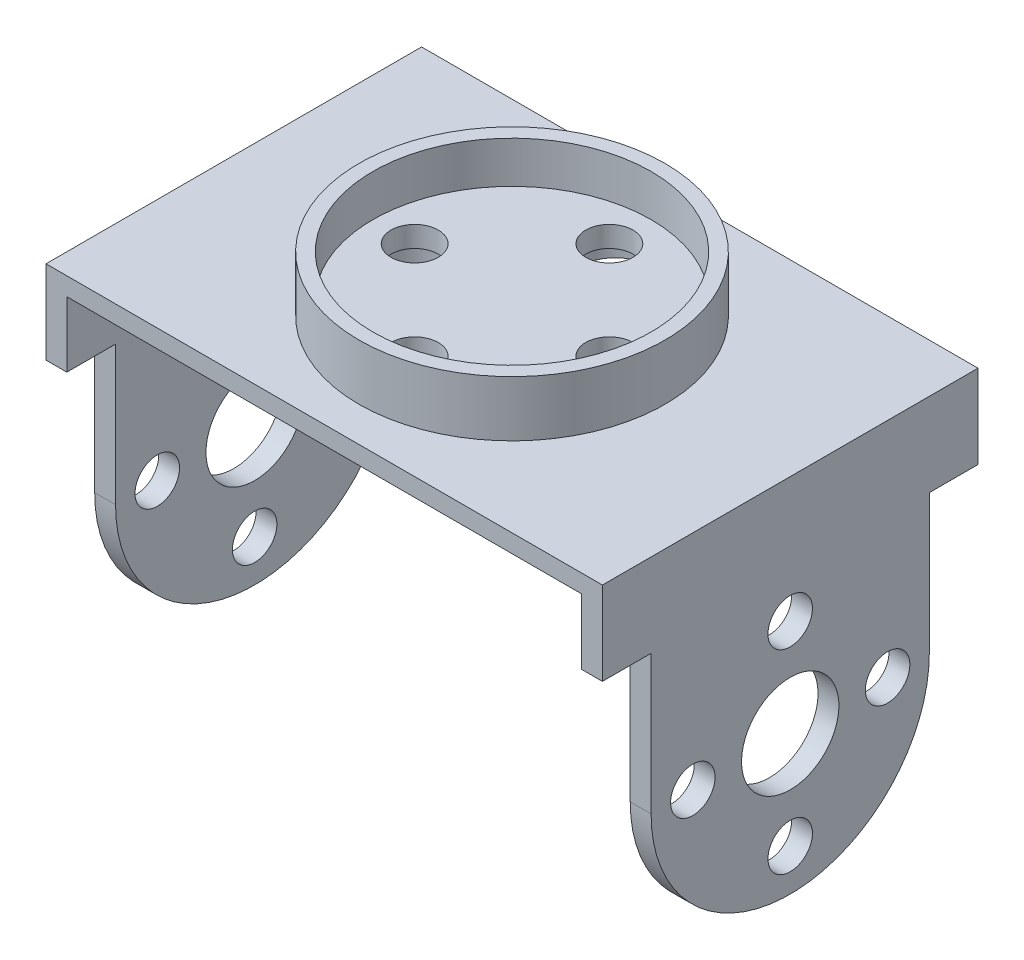
from build123d import *

# Parameters (mm, degrees)
SKETCH_1_W               = 40
SKETCH_1_H               = 28
EXTRUDE_1_DEPTH          = 27
SKETCH_2_W               = 37
SKETCH_2_H               = 27
CUT_EXTRUDE_1_DEPTH      = 25
SKETCH_3_R               = 1.6
SKETCH_3_R_2             = 3.5
CUT_EXTRUDE_2_DEPTH      = 56.794264938
SKETCH_4_R               = 11
SKETCH_4_R_2             = 10
EXTRUDE_2_DEPTH          = 4
SKETCH_11_R              = 10
EXTRUDE_3_DEPTH          = 1
CUT_EXTRUDE_3_DEPTH      = 56.794264938
CUT_EXTRUDE_3_DEPTH_BACK = 56.794264938
SKETCH_6_R               = 1.7
SKETCH_7_R               = 2.8
CUT_EXTRUDE_4_DEPTH      = 2.5
CUT_EXTRUDE_6_REACH      = 58.879
CUT_EXTRUDE_5_DEPTH      = 58.905094767


with BuildPart() as part:
    # 草图1 → 凸台-拉伸1 (new body)
    with BuildSketch(Plane.XY):
        with Locations((20, 14)):
            Rectangle(SKETCH_1_W, SKETCH_1_H)
    extrude(amount=EXTRUDE_1_DEPTH)

    # 草图2 → 切除-拉伸1 (cut)
    with BuildSketch(Plane.XZ):
        with Locations((20, 13.5)):
            Rectangle(SKETCH_2_W, SKETCH_2_H)
    extrude(amount=-CUT_EXTRUDE_1_DEPTH, mode=Mode.SUBTRACT)

    # 草图3 → 切除-拉伸2 (cut, through all)
    with BuildSketch(Plane.ZY):
        with Locations((13.5, 5)):
            Circle(SKETCH_3_R)
        with Locations((13.5, 12)):
            Circle(SKETCH_3_R_2)
        with Locations((6.5, 12)):
            Circle(SKETCH_3_R)
        with Locations((20.5, 12)):
            Circle(SKETCH_3_R)
        with Locations((13.5, 19)):
            Circle(SKETCH_3_R)
    extrude(amount=-CUT_EXTRUDE_2_DEPTH, mode=Mode.SUBTRACT)

    # 草图4 → 凸台-拉伸2 (add)
    with BuildSketch(Plane(origin=(0, 28, 0), x_dir=(1, 0, 0), z_dir=(0, 1, 0))):
        with Locations(Location((20, -13.5, 0), (0, 0, 90))):
            Circle(SKETCH_4_R)
        with Locations(Location((20, -13.5, 0), (0, 0, 270))):
            Circle(SKETCH_4_R_2, mode=Mode.SUBTRACT)
    extrude(amount=EXTRUDE_2_DEPTH)

    # 草图11 → 凸台-拉伸3 (add)
    with BuildSketch(Plane(origin=(0, 28, 0), x_dir=(1, 0, 0), z_dir=(0, 1, 0))):
        with Locations(Location((20, -13.5, 0), (0, 0, 270))):
            Circle(SKETCH_11_R)
    extrude(amount=EXTRUDE_3_DEPTH)

    # 草图6 → 切除-拉伸3 (cut, two sides: drawn at the far end of the back side and taken through both)
    with BuildSketch(Plane(origin=(0, 28, 0), x_dir=(1, 0, 0), z_dir=(0, 1, 0)).offset(-CUT_EXTRUDE_3_DEPTH_BACK)):
        with Locations(Location((20, -6.5, 0), (0, 0, 270))):
            Circle(SKETCH_6_R)
        with Locations(Location((27, -13.5, 0), (0, 0, 270))):
            Circle(SKETCH_6_R)
        with Locations(Location((20, -20.5, 0), (0, 0, 270))):
            Circle(SKETCH_6_R)
        with Locations(Location((13, -13.5, 0), (0, 0, 270))):
            Circle(SKETCH_6_R)
    extrude(amount=CUT_EXTRUDE_3_DEPTH + CUT_EXTRUDE_3_DEPTH_BACK, mode=Mode.SUBTRACT)

    # 草图7 → 切除-拉伸4 (cut)
    with BuildSketch(Plane.XZ.offset(-25)):
        with Locations(Location((20, 20.5, 0), (0, 0, 270))):
            Circle(SKETCH_7_R)
        with Locations(Location((27, 13.5, 0), (0, 0, 270))):
            Circle(SKETCH_7_R)
        with Locations(Location((20, 6.5, 0), (0, 0, 270))):
            Circle(SKETCH_7_R)
        with Locations(Location((13, 13.5, 0), (0, 0, 270))):
            Circle(SKETCH_7_R)
    extrude(amount=-CUT_EXTRUDE_4_DEPTH, mode=Mode.SUBTRACT)

    # 切除-拉伸6: up to this face of the body (flat: up to its plane)
    cut_extrude_6_end = Plane(part.part.faces().sort_by_distance((38.5, 12.5, 0.36796739))[0])
    # 草图10 → 切除-拉伸6 (cut, up to the picked face)
    with BuildSketch(Plane(origin=(1.5, 0, 0), x_dir=(0, 0, -1), z_dir=(1, 0, 0)), mode=Mode.PRIVATE) as cut_extrude_6_sk1:
        Polygon((-13.5, 25), (0, 25), (0, 26.7), align=None)
    cut_extrude_6_tool1 = split(extrude(cut_extrude_6_sk1.sketch, amount=CUT_EXTRUDE_6_REACH, mode=Mode.PRIVATE), bisect_by=cut_extrude_6_end, keep=Keep.BOTH, mode=Mode.PRIVATE)
    # 草图10 → 切除-拉伸6 (cut, up to the picked face)
    with BuildSketch(Plane(origin=(1.5, 0, 0), x_dir=(0, 0, -1), z_dir=(1, 0, 0)), mode=Mode.PRIVATE) as cut_extrude_6_sk2:
        Polygon((-27, 25), (-13.5, 25), (-27, 26.7), align=None)
    cut_extrude_6_tool2 = split(extrude(cut_extrude_6_sk2.sketch, amount=CUT_EXTRUDE_6_REACH, mode=Mode.PRIVATE), bisect_by=cut_extrude_6_end, keep=Keep.BOTH, mode=Mode.PRIVATE)
    add(cut_extrude_6_tool1.solids().sort_by(Axis((1.5, 25.566667, 4.5), (1, 0, 0)))[0], mode=Mode.SUBTRACT)
    add(cut_extrude_6_tool2.solids().sort_by(Axis((1.5, 25.566667, 22.5), (1, 0, 0)))[0], mode=Mode.SUBTRACT)

    # 草图9 → 切除-拉伸5 (cut, through all)
    with BuildSketch(Plane.ZY):
        with BuildLine():
            Line((3.5, 22), (0, 22))
            Line((0, 22), (0, 0))
            Line((0, 0), (27, 0))
            Line((27, 0), (27, 22))
            Line((27, 22), (23.5, 22))
            Line((23.5, 22), (23.5, 12))
            ThreePointArc((23.5, 12), (13.5, 2), (3.5, 12))
            Line((3.5, 12), (3.5, 22))
        make_face()
    extrude(amount=-CUT_EXTRUDE_5_DEPTH, mode=Mode.SUBTRACT)


solid = part.part
